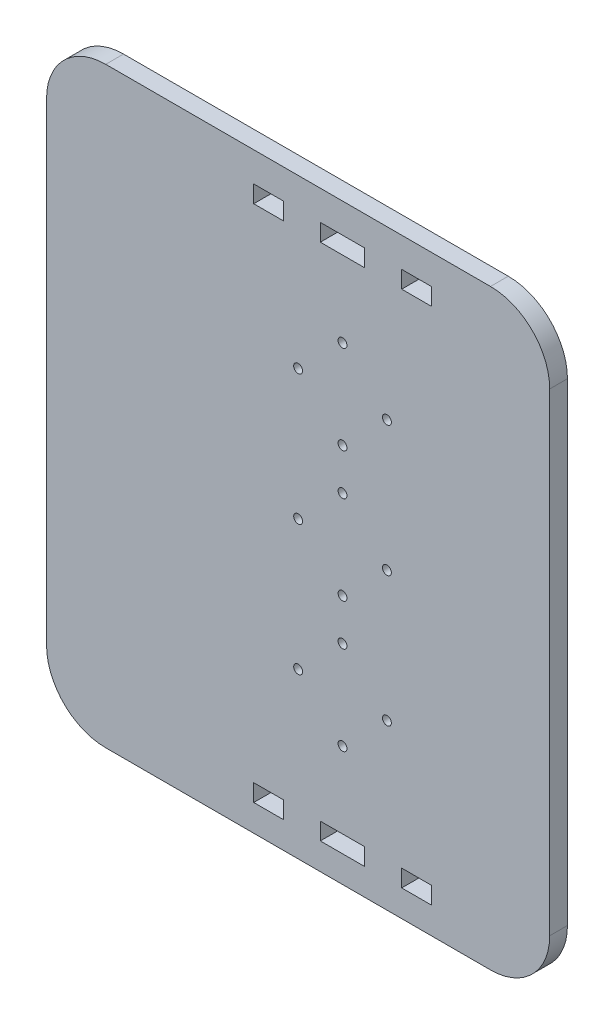
from build123d import *

# Parameters (mm, degrees)
SKETCH1_R           = 0.75
SKETCH1_W           = 6.25
SKETCH1_H           = 2.9
BOSS_EXTRUDE1_DEPTH = 3


with BuildPart() as part:
    # Sketch1 → Boss-Extrude1 (new body)
    # profile 1 of 6: a face of its own
    with BuildSketch(Plane.XY):
        with BuildLine():
            ThreePointArc((-50, 40.25), (-47.071067812, 47.321067812), (-40, 50.25))
            Line((-40, 50.25), (25, 50.25))
            ThreePointArc((25, 50.25), (32.071067812, 47.321067812), (35, 40.25))
            Line((35, 40.25), (35, -39.75))
            ThreePointArc((35, -39.75), (32.071067812, -46.821067812), (25, -49.75))
            Line((25, -49.75), (-40, -49.75))
            ThreePointArc((-40, -49.75), (-47.071067812, -46.821067812), (-50, -39.75))
            Line((-50, -39.75), (-50, 40.25))
        make_face()
        Polygon((-3.75, -45.25), (3.75, -45.25), (10, -45.25), (15, -45.25), (15, -42.35), (15, 42.35), (15, 45.25), (10, 45.25), (3.75, 45.25), (-3.75, 45.25), (-10, 45.25), (-15, 45.25), (-15, 42.35), (-15, -42.35), (-15, -45.25), (-10, -45.25), align=None, mode=Mode.SUBTRACT)
    # profile 2 of 6: a face of its own
    with BuildSketch(Plane.XY):
        Polygon((-3.75, -42.35), (3.75, -42.35), (10, -42.35), (15, -42.35), (15, 42.35), (10, 42.35), (3.75, 42.35), (-3.75, 42.35), (-10, 42.35), (-15, 42.35), (-15, -42.35), (-10, -42.35), align=None)
        with Locations((7.5, -22)):
            Circle(SKETCH1_R, mode=Mode.SUBTRACT)
        with Locations((0, -29.5)):
            Circle(SKETCH1_R, mode=Mode.SUBTRACT)
        with Locations((-7.5, -22)):
            Circle(SKETCH1_R, mode=Mode.SUBTRACT)
        with Locations((0, -14.5)):
            Circle(SKETCH1_R, mode=Mode.SUBTRACT)
        with Locations((7.5, 0)):
            Circle(SKETCH1_R, mode=Mode.SUBTRACT)
        with Locations((0, -7.5)):
            Circle(SKETCH1_R, mode=Mode.SUBTRACT)
        with Locations((-7.5, 0)):
            Circle(SKETCH1_R, mode=Mode.SUBTRACT)
        with Locations((0, 7.5)):
            Circle(SKETCH1_R, mode=Mode.SUBTRACT)
        with Locations((-7.5, 22)):
            Circle(SKETCH1_R, mode=Mode.SUBTRACT)
        with Locations((0, 14.5)):
            Circle(SKETCH1_R, mode=Mode.SUBTRACT)
        with Locations((7.5, 22)):
            Circle(SKETCH1_R, mode=Mode.SUBTRACT)
        with Locations((0, 29.5)):
            Circle(SKETCH1_R, mode=Mode.SUBTRACT)
    # profile 3 of 6: a face of its own
    with BuildSketch(Plane.XY):
        with Locations((-6.875, 43.8)):
            Rectangle(SKETCH1_W, SKETCH1_H)
    # profile 4 of 6: a face of its own
    with BuildSketch(Plane.XY):
        with Locations((6.875, 43.8)):
            Rectangle(SKETCH1_W, SKETCH1_H)
    # profile 5 of 6: a face of its own
    with BuildSketch(Plane.XY):
        with Locations((-6.875, -43.8)):
            Rectangle(SKETCH1_W, SKETCH1_H)
    # profile 6 of 6: a face of its own
    with BuildSketch(Plane.XY):
        with Locations((6.875, -43.8)):
            Rectangle(SKETCH1_W, SKETCH1_H)
    extrude(amount=BOSS_EXTRUDE1_DEPTH)


solid = part.part
